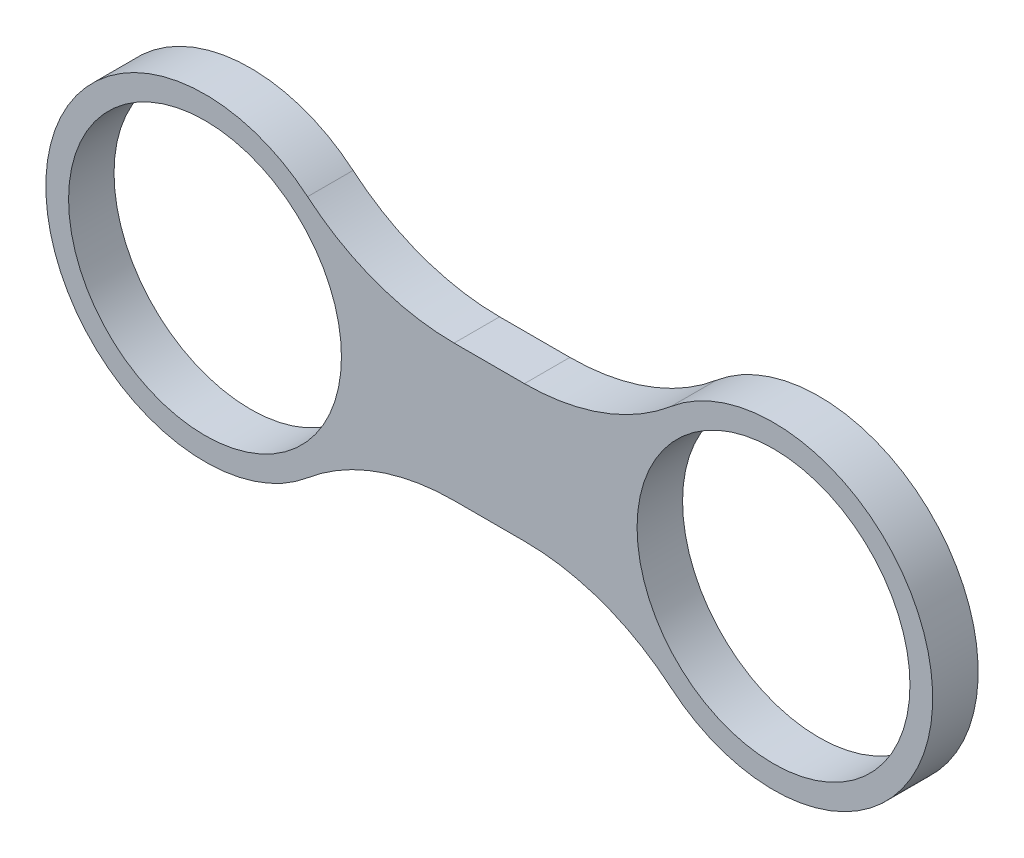
from build123d import *

# Parameters (mm, degrees)
SKETCH1_R           = 6
BOSS_EXTRUDE1_DEPTH = 2
FILLET1_R           = 10


with BuildPart() as part:
    # Sketch1 → Boss-Extrude1 (new body)
    with BuildSketch(Plane.XY):
        with BuildLine():
            ThreePointArc((-6.17544468, 3), (-19.5, 0), (-6.17544468, -3))
            Line((-6.17544468, -3), (6.17544468, -3))
            ThreePointArc((6.17544468, -3), (19.5, 0), (6.17544468, 3))
            Line((6.17544468, 3), (-6.17544468, 3))
        make_face()
        with Locations((-12.5, 0)):
            Circle(SKETCH1_R, mode=Mode.SUBTRACT)
        with Locations((12.5, 0)):
            Circle(SKETCH1_R, mode=Mode.SUBTRACT)
    extrude(amount=BOSS_EXTRUDE1_DEPTH)

    # Fillet1
    fillet1_edges = [part.edges().sort_by_distance(p)[0] for p in [
        (-6.17544468, 3, 1),
        (6.17544468, 3, 1),
        (6.17544468, -3, 1),
        (-6.17544468, -3, 1),
    ]]
    fillet(fillet1_edges, radius=FILLET1_R)


solid = part.part
